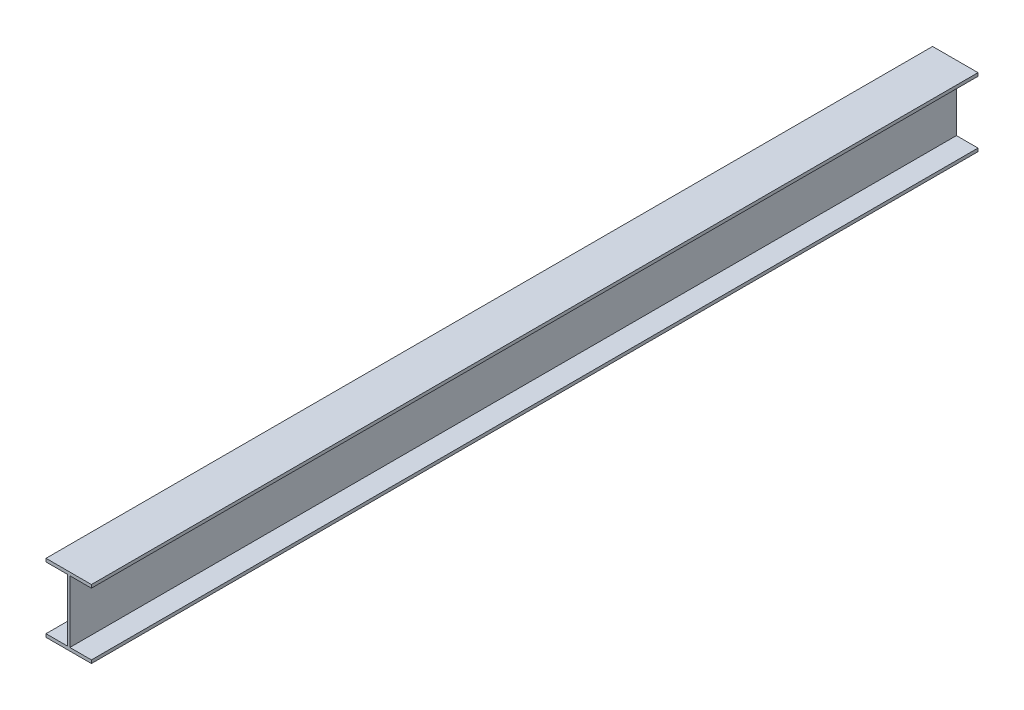
from build123d import *

# Parameters (mm, degrees)
BOSS_EXTRUDE1_DEPTH = 1800
BOSS_EXTRUDE2_DEPTH = 183.1


with BuildPart() as part:
    # Sketch1 → Boss-Extrude1 (new body)
    with BuildSketch(Plane.XY):
        Polygon((0, -0.000240533), (101.6, -0.000240533), (101.6, -7.112240533), (53.408035714, -7.112240533), (53.408035714, -146.050240533), (101.6, -146.050240533), (101.6, -153.162240533), (0, -153.162240533), (0, -146.050240533), (47.566035714, -146.050240533), (47.566035714, -7.112240533), (0, -7.112240533), align=None)
    extrude(amount=BOSS_EXTRUDE1_DEPTH)

    # Sketch3 → Boss-Extrude2 (add)
    with BuildSketch(Plane(origin=(0, 0, 0), x_dir=(-1, 0, 0), z_dir=(0, 0, -1))):
        Polygon((0, -7.112240533), (0, -0.000240533), (-101.6, -0.000240533), (-101.6, -7.112240533), (-53.408035714, -7.112240533), (-53.408035714, -146.050240533), (-101.6, -146.050240533), (-101.6, -153.162240533), (0, -153.162240533), (0, -146.050240533), (-47.566035714, -146.050240533), (-47.566035714, -7.112240533), align=None)
    extrude(amount=BOSS_EXTRUDE2_DEPTH)


solid = part.part
